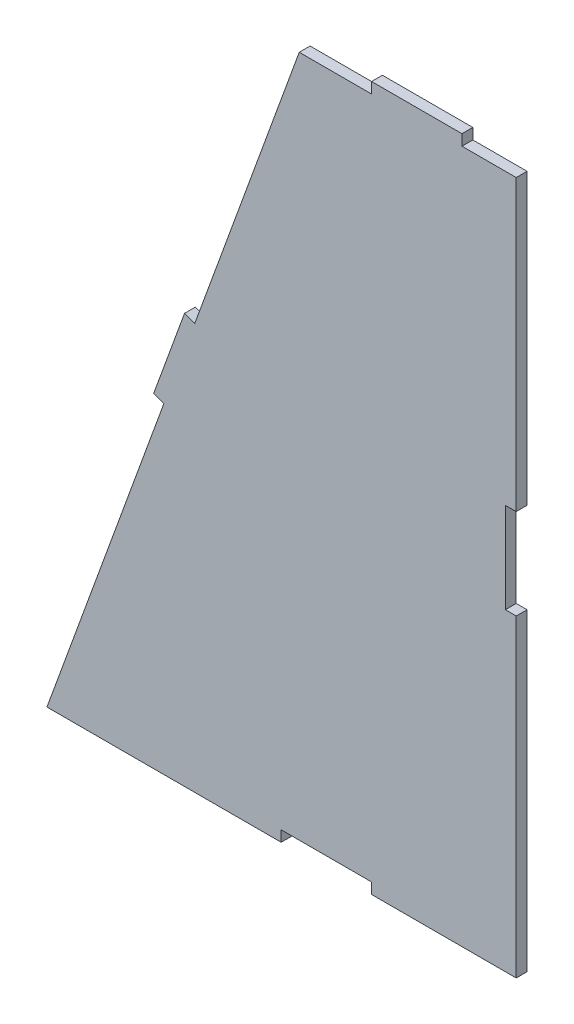
from build123d import *

# Parameters (mm, degrees)
EXTRUDE_1_DEPTH = 3


with BuildPart() as part:
    # Эскиз1 → Бобышка-Вытянуть1 (new body)
    with BuildSketch(Plane.XY):
        Polygon((-38.466499373, 0), (26.305609866, 0), (26.305609866, 3), (51.305609866, 3), (51.305609866, 0), (91.305609866, 0), (91.305609866, 86.69729464), (88.305609866, 86.69729464), (88.305609866, 111.69729464), (91.305609866, 111.69729464), (91.305609866, 191.69729464), (76.305609866, 191.69729464), (76.305609866, 194.69729464), (51.305609866, 194.69729464), (51.305609866, 191.69729464), (31.305609866, 191.69729464), (2.404907755, 112.293268184), (-0.414170108, 113.319328614), (-8.964673691, 89.827013094), (-6.145595828, 88.800952664), align=None)
    extrude(amount=EXTRUDE_1_DEPTH)


solid = part.part
